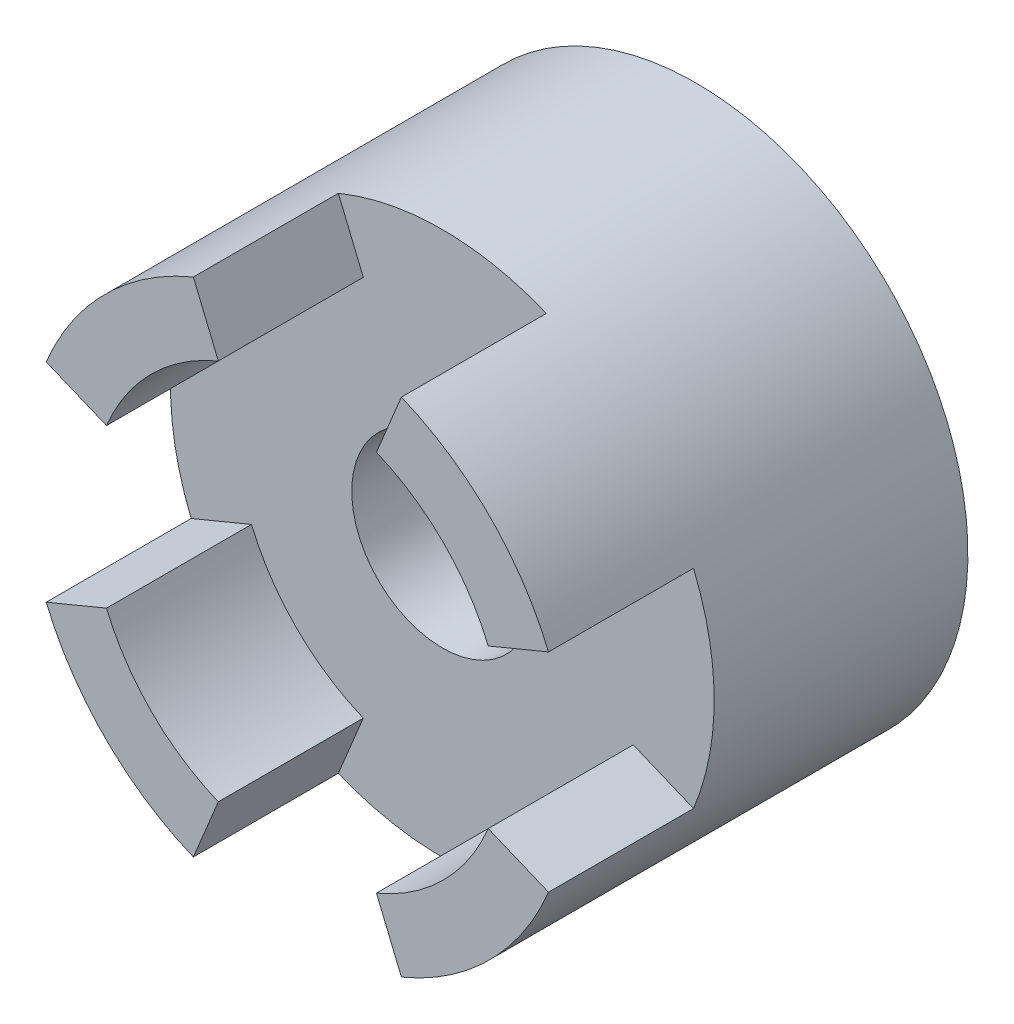
from build123d import *

# Parameters (mm, degrees)
SKETCH1_R           = 19.05
SKETCH1_R_2         = 14.478
BOSS_EXTRUDE1_DEPTH = 38.1
BOSS_EXTRUDE2_START = -10.16
SKETCH2_R           = 14.478
SKETCH2_R_2         = 6.35
BOSS_EXTRUDE2_DEPTH = 27.94
CUT_EXTRUDE1_DEPTH  = 10.16
CUT_EXTRUDE2_START  = -10.16
SKETCH4_R           = 19.05
SKETCH4_R_2         = 6.35
CUT_EXTRUDE2_DEPTH  = 10.16


with BuildPart() as part:
    # Sketch1 → Boss-Extrude1 (new body)
    with BuildSketch(Plane.XY):
        Circle(SKETCH1_R)
        Circle(SKETCH1_R_2, mode=Mode.SUBTRACT)
    extrude(amount=-BOSS_EXTRUDE1_DEPTH)

    # Sketch2 → Boss-Extrude2 (add)
    with BuildSketch(Plane.XY.offset(BOSS_EXTRUDE2_START)):
        Circle(SKETCH2_R)
        Circle(SKETCH2_R_2, mode=Mode.SUBTRACT)
    extrude(amount=-BOSS_EXTRUDE2_DEPTH)

    # Sketch3 → Cut-Extrude1 (cut)
    with BuildSketch(Plane.XY):
        with BuildLine():
            Line((-5.540490734, 13.375927872), (-7.290119387, 17.599905094))
            ThreePointArc((-7.290119387, 17.599905094), (0, 19.05), (7.290119387, 17.599905094))
            Line((7.290119387, 17.599905094), (5.540490734, 13.375927872))
            ThreePointArc((5.540490734, 13.375927872), (0, 14.478), (-5.540490734, 13.375927872))
        make_face()
        with BuildLine():
            Line((13.375927872, 5.540490734), (17.599905094, 7.290119387))
            ThreePointArc((17.599905094, 7.290119387), (19.05, 0), (17.599905094, -7.290119387))
            Line((17.599905094, -7.290119387), (13.375927872, -5.540490734))
            ThreePointArc((13.375927872, -5.540490734), (14.478, 0), (13.375927872, 5.540490734))
        make_face()
        with BuildLine():
            Line((5.540490734, -13.375927872), (7.290119387, -17.599905094))
            ThreePointArc((7.290119387, -17.599905094), (0, -19.05), (-7.290119387, -17.599905094))
            Line((-7.290119387, -17.599905094), (-5.540490734, -13.375927872))
            ThreePointArc((-5.540490734, -13.375927872), (0, -14.478), (5.540490734, -13.375927872))
        make_face()
        with BuildLine():
            Line((-13.375927872, -5.540490734), (-17.599905094, -7.290119387))
            ThreePointArc((-17.599905094, -7.290119387), (-19.05, 0), (-17.599905094, 7.290119387))
            Line((-17.599905094, 7.290119387), (-13.375927872, 5.540490734))
            ThreePointArc((-13.375927872, 5.540490734), (-14.478, 0), (-13.375927872, -5.540490734))
        make_face()
    extrude(amount=-CUT_EXTRUDE1_DEPTH, mode=Mode.SUBTRACT)

    # Sketch4 → Cut-Extrude2 (cut)
    with BuildSketch(Plane(origin=(0, 0, -38.1), x_dir=(-1, 0, 0), z_dir=(0, 0, -1)).offset(CUT_EXTRUDE2_START)):
        with Locations(Location((0, 0, 0), (0, 0, 157.5))):
            Circle(SKETCH4_R)
        with Locations(Location((0, 0, 0), (0, 0, 180))):
            Circle(SKETCH4_R_2, mode=Mode.SUBTRACT)
    extrude(amount=CUT_EXTRUDE2_DEPTH, mode=Mode.SUBTRACT)


solid = part.part
